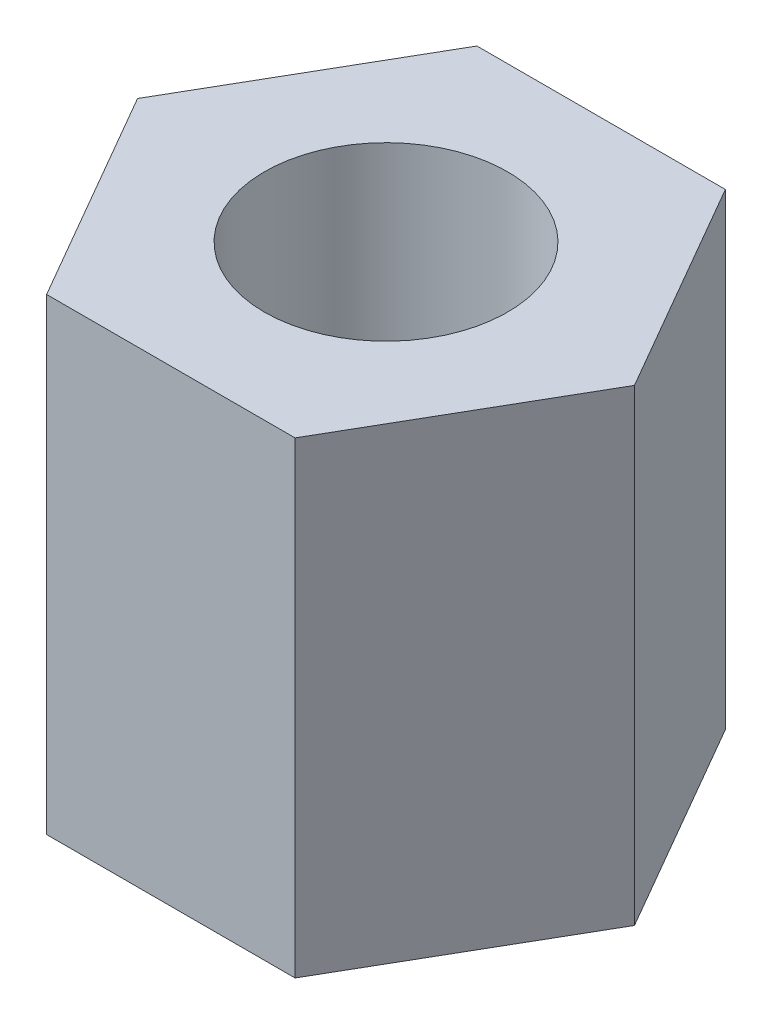
from build123d import *

# Parameters (mm, degrees)
CROQUIS1_R              = 1.3
SALIENTE_EXTRUIR1_DEPTH = 5


with BuildPart() as part:
    # Croquis1 → Saliente-Extruir1 (new body)
    with BuildSketch(Plane(origin=(0, 0, 0), x_dir=(1, 0, 0), z_dir=(0, 1, 0))):
        Polygon((1.327905619, -2.3), (2.655811238, 0), (1.327905619, 2.3), (-1.327905619, 2.3), (-2.655811238, 0), (-1.327905619, -2.3), align=None)
        with Locations(Location((0, 0, 0), (0, 0, 270))):
            Circle(CROQUIS1_R, mode=Mode.SUBTRACT)
    extrude(amount=SALIENTE_EXTRUIR1_DEPTH)


solid = part.part
